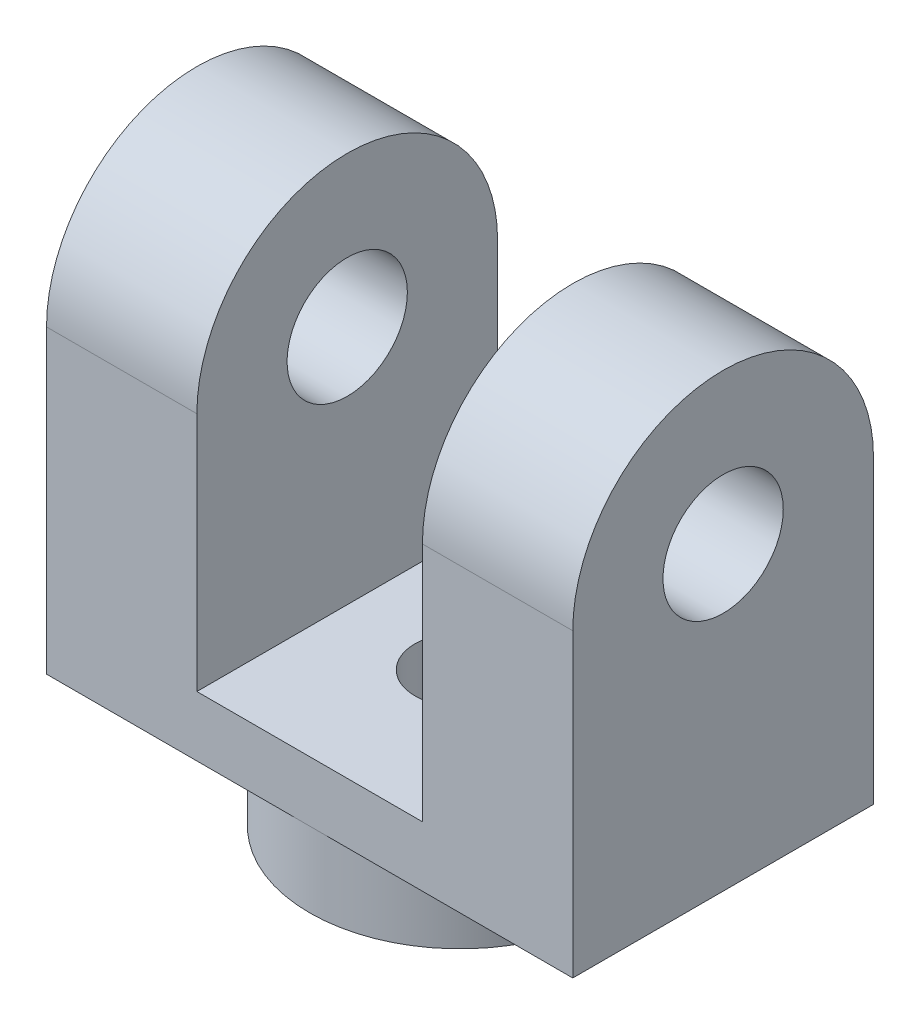
from build123d import *

# Parameters (mm, degrees)
SKETCH1_R               = 50
SKETCH1_R_2             = 37.5
BOSS_EXTRUDE1_DEPTH     = 25
BOSS_EXTRUDE2_DEPTH     = 87.5
CUT_EXTRUDE1_DEPTH      = 201.390244274
CUT_EXTRUDE1_DEPTH_BACK = 201.390244274
SKETCH3_W               = 75
SKETCH3_H               = 130
SKETCH4_R               = 15
CUT_EXTRUDE2_DEPTH      = 165.487841496
SKETCH5_R               = 20
CUT_EXTRUDE3_DEPTH      = 236.849528301


with BuildPart() as part:
    # Sketch1 → Boss-Extrude1 (new body)
    with BuildSketch(Plane(origin=(0, 0, 0), x_dir=(1, 0, 0), z_dir=(0, 1, 0))):
        with Locations(Location((0, 0, 0), (0, 0, 270))):
            Circle(SKETCH1_R)
        with Locations(Location((0, 0, 0), (0, 0, 270))):
            Circle(SKETCH1_R_2, mode=Mode.SUBTRACT)
    extrude(amount=-BOSS_EXTRUDE1_DEPTH)

    # Sketch2 → Boss-Extrude2 (add, symmetric)
    with BuildSketch(Plane(origin=(0, 0, 0), x_dir=(0, 0, -1), z_dir=(1, 0, 0))):
        with BuildLine():
            Line((-50, 0), (50, 0))
            Line((50, 0), (50, 100))
            ThreePointArc((50, 100), (0, 150), (-50, 100))
            Line((-50, 100), (-50, 0))
        make_face()
    extrude(amount=BOSS_EXTRUDE2_DEPTH, both=True)

    # Sketch3 → Cut-Extrude1 (cut, two sides: drawn at the far end of the back side and taken through both)
    with BuildSketch(Plane.XY.offset(50).offset(-CUT_EXTRUDE1_DEPTH_BACK)):
        with Locations((0, 85)):
            Rectangle(SKETCH3_W, SKETCH3_H)
    extrude(amount=CUT_EXTRUDE1_DEPTH + CUT_EXTRUDE1_DEPTH_BACK, mode=Mode.SUBTRACT)

    # Sketch4 → Cut-Extrude2 (cut, through all)
    with BuildSketch(Plane(origin=(0, 20, 0), x_dir=(1, 0, 0), z_dir=(0, 1, 0))):
        with Locations(Location((0, 0, 0), (0, 0, 180))):
            Circle(SKETCH4_R)
    extrude(amount=-CUT_EXTRUDE2_DEPTH, mode=Mode.SUBTRACT)

    # Sketch5 → Cut-Extrude3 (cut, through all)
    with BuildSketch(Plane(origin=(87.5, 0, 0), x_dir=(0, 0, -1), z_dir=(1, 0, 0))):
        with Locations((0, 100)):
            Circle(SKETCH5_R)
    extrude(amount=-CUT_EXTRUDE3_DEPTH, mode=Mode.SUBTRACT)


solid = part.part
